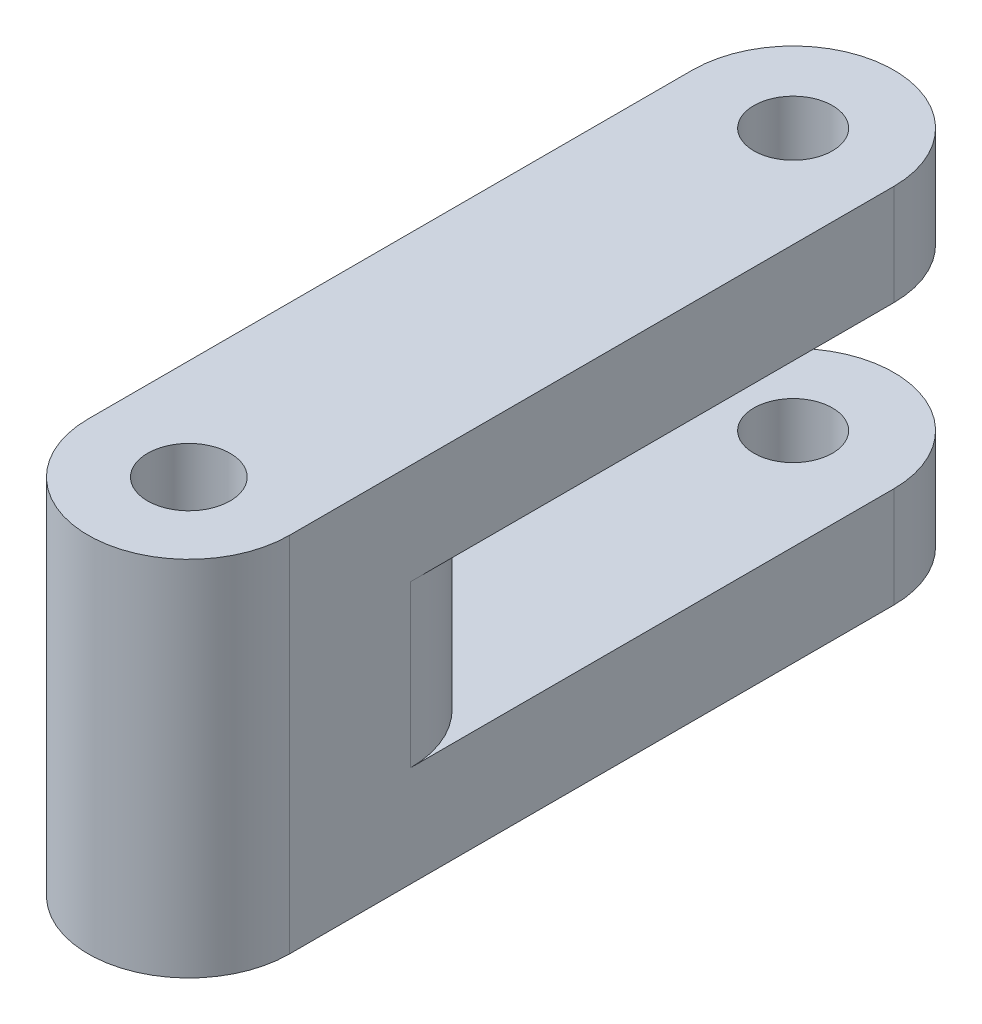
from build123d import *

# Parameters (mm, degrees)
ESQUISSE1_R        = 1.95
ESQUISSE1_R_2      = 2.05
BOSS_EXTRU_1_DEPTH = 5
ESQUISSE2_R        = 2.05
BOSS_EXTRU_2_DEPTH = 8
BOSS_EXTRU_3_START = 8
ESQUISSE3_R        = 1.95
ESQUISSE3_R_2      = 2.05
BOSS_EXTRU_3_DEPTH = 5


with BuildPart() as part:
    # Esquisse1 → Boss.-Extru.1 (new body)
    with BuildSketch(Plane(origin=(0, 0, 0), x_dir=(1, 0, 0), z_dir=(0, 1, 0))):
        with BuildLine():
            Line((-5, 0), (-5, 30))
            ThreePointArc((-5, 30), (0, 35), (5, 30))
            Line((5, 30), (5, 0))
            ThreePointArc((5, 0), (0, -5), (-5, 0))
        make_face()
        with Locations(Location((0, 30, 0), (0, 0, 270))):
            Circle(ESQUISSE1_R, mode=Mode.SUBTRACT)
        with Locations(Location((0, 0, 0), (0, 0, 270))):
            Circle(ESQUISSE1_R_2, mode=Mode.SUBTRACT)
    extrude(amount=BOSS_EXTRU_1_DEPTH)

    # Esquisse2 → Boss.-Extru.2 (add)
    with BuildSketch(Plane(origin=(0, 5, 0), x_dir=(1, 0, 0), z_dir=(0, 1, 0))):
        with BuildLine():
            Line((-5, 0), (-5, 6))
            ThreePointArc((-5, 6), (0, 11), (5, 6))
            Line((5, 6), (5, 0))
            ThreePointArc((5, 0), (0, -5), (-5, 0))
        make_face()
        with Locations(Location((0, 0, 0), (0, 0, 270))):
            Circle(ESQUISSE2_R, mode=Mode.SUBTRACT)
    extrude(amount=BOSS_EXTRU_2_DEPTH)

    # Esquisse3 → Boss.-Extru.3 (add)
    # profile 1 of 2: a face of its own
    with BuildSketch(Plane(origin=(0, 5, 0), x_dir=(1, 0, 0), z_dir=(0, 1, 0)).offset(BOSS_EXTRU_3_START)):
        with BuildLine():
            Line((-5, 30), (-5, 6))
            ThreePointArc((-5, 6), (0, 11), (5, 6))
            Line((5, 6), (5, 30))
            ThreePointArc((5, 30), (0, 35), (-5, 30))
        make_face()
        with Locations(Location((0, 30, 0), (0, 0, 270))):
            Circle(ESQUISSE3_R, mode=Mode.SUBTRACT)
    # profile 2 of 2: a face of its own
    with BuildSketch(Plane(origin=(0, 5, 0), x_dir=(1, 0, 0), z_dir=(0, 1, 0)).offset(BOSS_EXTRU_3_START)):
        with BuildLine():
            Line((-5, 6), (-5, 0))
            ThreePointArc((-5, 0), (0, -5), (5, 0))
            Line((5, 0), (5, 6))
            ThreePointArc((5, 6), (0, 11), (-5, 6))
        make_face()
        with Locations(Location((0, 0, 0), (0, 0, 270))):
            Circle(ESQUISSE3_R_2, mode=Mode.SUBTRACT)
    extrude(amount=BOSS_EXTRU_3_DEPTH)


solid = part.part
